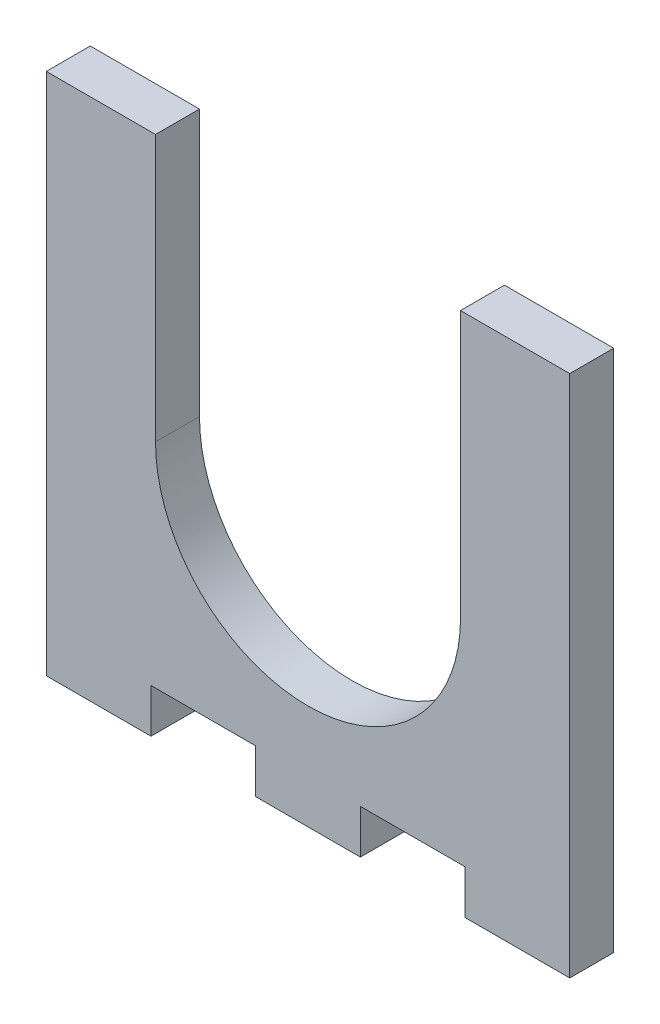
from build123d import *

# Parameters (mm, degrees)
SKETCH1_W           = 63.5
SKETCH1_H           = 63.5
BOSS_EXTRUDE1_DEPTH = 5.334
SKETCH2_R           = 18.5
SKETCH2_W           = 12.7
SKETCH2_H           = 5.334
CUT_EXTRUDE1_DEPTH  = 5.334
SKETCH3_W           = 37
SKETCH3_H           = 32.300000043
CUT_EXTRUDE2_DEPTH  = 5.334


with BuildPart() as part:
    # Sketch1 → Boss-Extrude1 (new body)
    with BuildSketch(Plane.XY):
        with Locations((31.75, 31.75)):
            Rectangle(SKETCH1_W, SKETCH1_H)
    extrude(amount=BOSS_EXTRUDE1_DEPTH)

    # Sketch2 → Cut-Extrude1 (cut)
    with BuildSketch(Plane.XY.offset(5.334)):
        with Locations((31.75, 31.199999957)):
            Circle(SKETCH2_R)
        with Locations((19.05, 2.667)):
            Rectangle(SKETCH2_W, SKETCH2_H)
        with Locations((44.45, 2.667)):
            Rectangle(SKETCH2_W, SKETCH2_H)
    extrude(amount=-CUT_EXTRUDE1_DEPTH, mode=Mode.SUBTRACT)

    # Sketch3 → Cut-Extrude2 (cut)
    with BuildSketch(Plane.XY.offset(5.334)):
        with Locations((31.75, 47.349999979)):
            Rectangle(SKETCH3_W, SKETCH3_H)
    extrude(amount=-CUT_EXTRUDE2_DEPTH, mode=Mode.SUBTRACT)


solid = part.part
